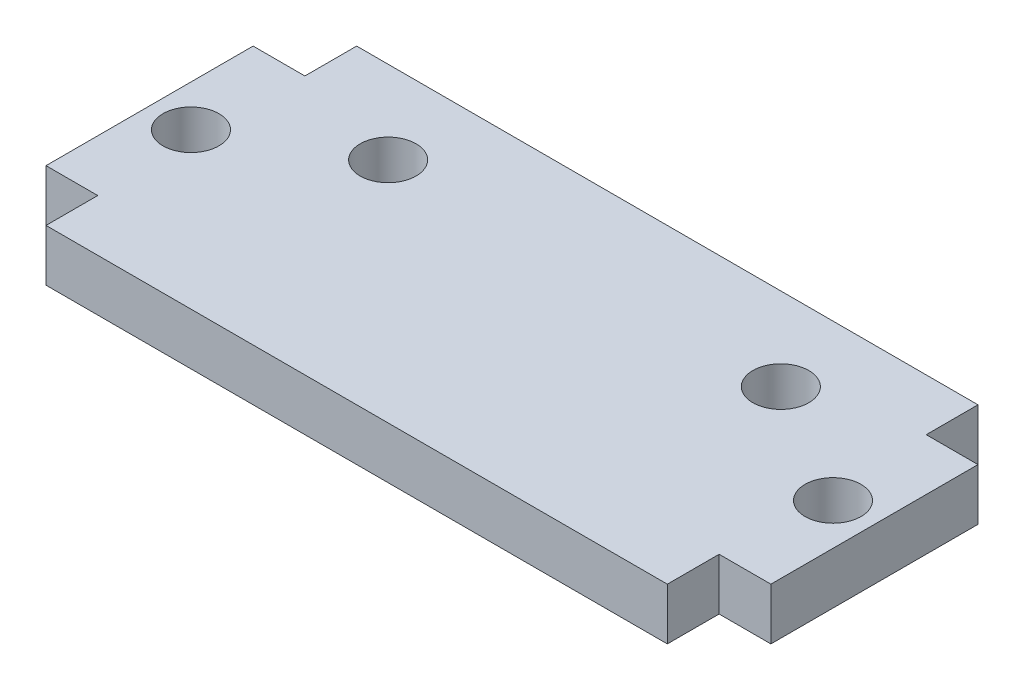
from build123d import *

# Parameters (mm, degrees)
SKETCH1_R           = 1.7145
BOSS_EXTRUDE2_DEPTH = 3.175


with BuildPart() as part:
    # Sketch1 → Boss-Extrude2 (new body)
    with BuildSketch(Plane(origin=(0, 0, 0), x_dir=(1, 0, 0), z_dir=(0, 1, 0))):
        Polygon((19.05, 0), (-19.05, 0), (-19.05, 3.175), (-22.225, 3.175), (-22.225, 15.875), (-19.05, 15.875), (-19.05, 19.05), (19.05, 19.05), (19.05, 15.875), (22.225, 15.875), (22.225, 3.175), (19.05, 3.175), align=None)
        with Locations(Location((-19.685, 9.525, 0), (0, 0, 270))):
            Circle(SKETCH1_R, mode=Mode.SUBTRACT)
        with Locations(Location((19.685, 9.525, 0), (0, 0, 90))):
            Circle(SKETCH1_R, mode=Mode.SUBTRACT)
        with Locations(Location((-12.0396, 13.97, 0), (0, 0, 270))):
            Circle(SKETCH1_R, mode=Mode.SUBTRACT)
        with Locations(Location((12.0396, 13.97, 0), (0, 0, 90))):
            Circle(SKETCH1_R, mode=Mode.SUBTRACT)
    extrude(amount=BOSS_EXTRUDE2_DEPTH)


solid = part.part
